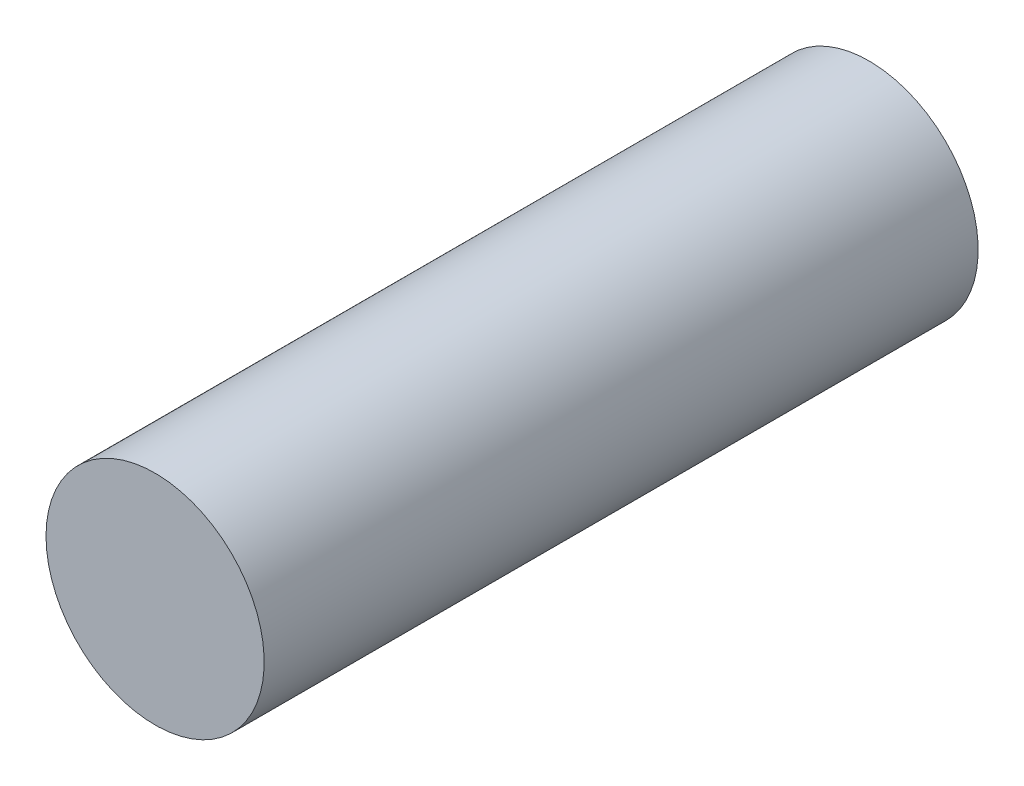
from build123d import *


with BuildPart() as part:
    # Sketch1 → Bore (revolve)
    with BuildSketch(Plane(origin=(0, 0, 0), x_dir=(-1, 0, 0), z_dir=(0, 1, 0)), mode=Mode.PRIVATE) as bore_sk:
        Polygon((-3.8, 0), (-5.5, 0), (-5.5, 36), (0, 36), (0, 33), (-3.4, 33), (-3.4, 0.4), align=None)
    revolve(bore_sk.sketch.rotate(Axis((0, 0, -200), (0, 0, 1)), 180), axis=Axis((0, 0, -200), (0, 0, 1)))


with BuildPart() as body_2:
    # Sketch2 → Detent (revolve)
    with BuildSketch(Plane(origin=(0, 0, 0), x_dir=(-1, 0, 0), z_dir=(0, 1, 0)), mode=Mode.PRIVATE) as detent_sk:
        Polygon((-3.6, 24.13), (-4.4, 24.13), (-4.4, 27.93), (-3.6, 27.93), (-2.35, 24.43), align=None)
    revolve(detent_sk.sketch.rotate(Axis((0, 0, -200), (0, 0, 1)), 180), axis=Axis((0, 0, -200), (0, 0, 1)))


solid = Compound([part.part, body_2.part])
